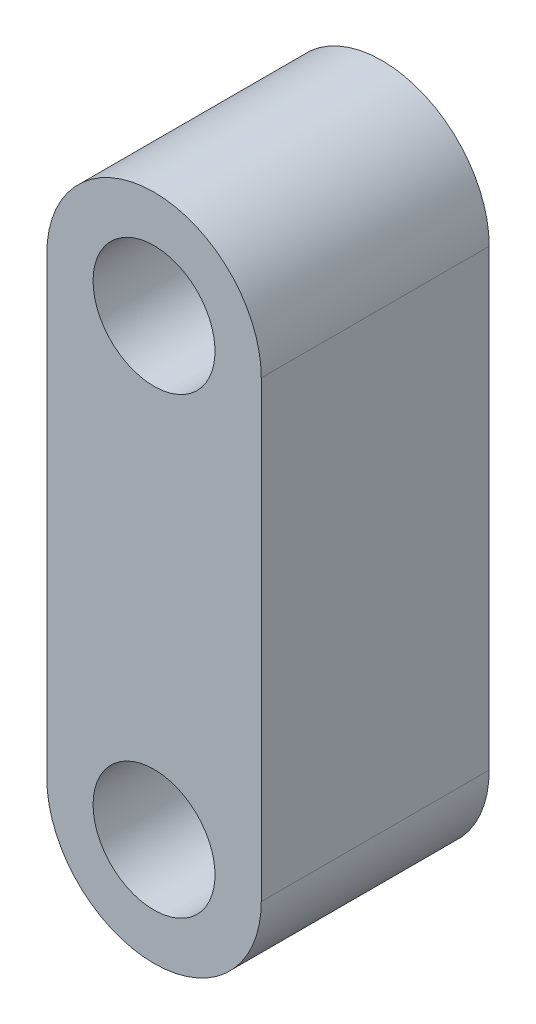
from build123d import *

# Parameters (mm, degrees)
SKETCH1_R           = 5.09524
BOSS_EXTRUDE1_DEPTH = 19.05


with BuildPart() as part:
    # Sketch1 → Boss-Extrude1 (new body)
    with BuildSketch(Plane.XY):
        with BuildLine():
            Line((-8.963063795, -18.953145317), (-8.963063795, 18.953145317))
            ThreePointArc((-8.963063795, 18.953145317), (0, 27.916209112), (8.963063795, 18.953145317))
            Line((8.963063795, 18.953145317), (8.963063795, -18.953145317))
            ThreePointArc((8.963063795, -18.953145317), (0, -27.916209112), (-8.963063795, -18.953145317))
        make_face()
        with Locations(Location((0, 18.953145317, 0), (0, 0, 180))):
            Circle(SKETCH1_R, mode=Mode.SUBTRACT)
        with Locations(Location((0, -18.953145317, 0), (0, 0, 180))):
            Circle(SKETCH1_R, mode=Mode.SUBTRACT)
    extrude(amount=BOSS_EXTRUDE1_DEPTH)


solid = part.part
